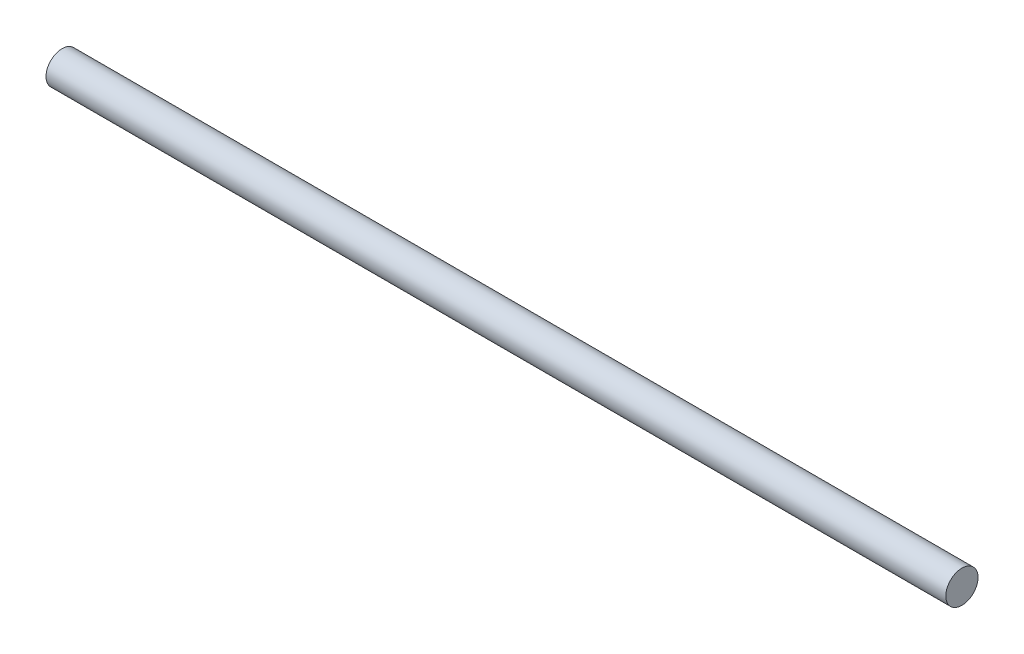
from build123d import *

# Parameters (mm, degrees)
SKETCH2_W = 221.522352046
SKETCH2_H = 3.96875


with BuildPart() as part:
    # Sketch2 → Revolve1 (revolve)
    with BuildSketch(Plane.XY, mode=Mode.PRIVATE) as revolve1_sk:
        with Locations((110.761176023, 1.984375)):
            Rectangle(SKETCH2_W, SKETCH2_H)
    revolve(revolve1_sk.sketch.rotate(Axis((0, 0, 0), (1, 0, 0)), 90), axis=Axis((0, 0, 0), (1, 0, 0)))


solid = part.part
